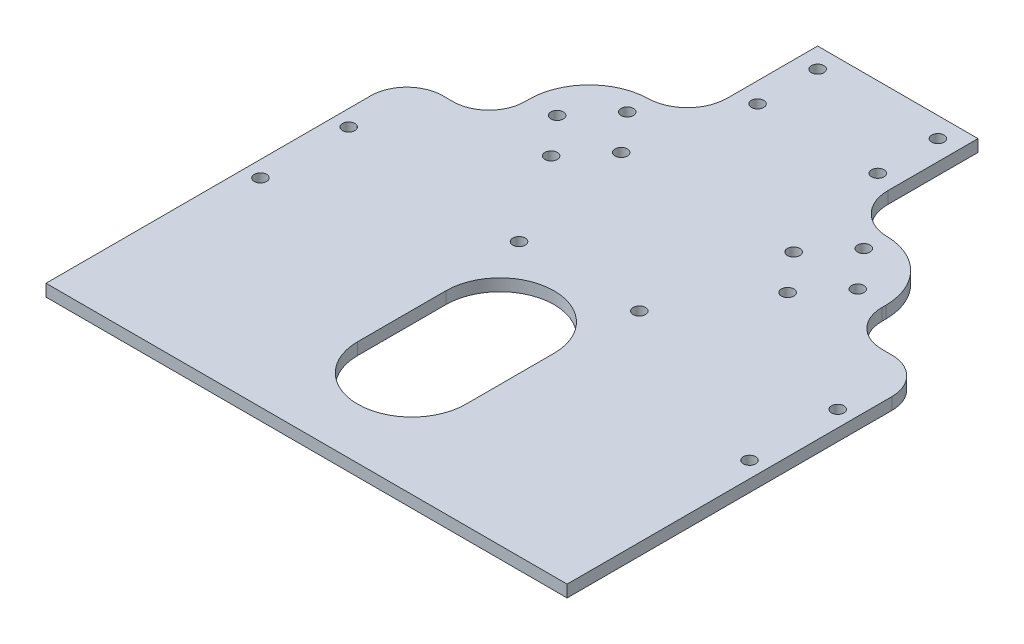
from build123d import *

# Parameters (mm, degrees)
SKETCH_1_W              = 200
SKETCH_1_H              = 200
EXTRUDE_1_DEPTH         = 3
SKETCH_2_R              = 1.55
CUT_EXTRUDE_2_DEPTH     = 10
CUT_EXTRUDE_3_DEPTH     = 10
SKETCH_6_R              = 1.55
CUT_EXTRUDE_3_1_1_DEPTH = 10
SKETCH_7_R              = 1.55
CUT_EXTRUDE_3_1_2_DEPTH = 120.306328416
CUT_EXTRUDE_21_DEPTH    = 10


with BuildPart() as part:
    # 草图1 → 凸台-拉伸1 (new body)
    with BuildSketch(Plane(origin=(0, 0, 0), x_dir=(1, 0, 0), z_dir=(0, 1, 0))):
        Rectangle(SKETCH_1_W, SKETCH_1_H)
    extrude(amount=EXTRUDE_1_DEPTH)

    # 草图2 → 切除-拉伸2 (cut)
    with BuildSketch(Plane(origin=(0, 3, 0), x_dir=(1, 0, 0), z_dir=(0, 1, 0))):
        with Locations(Location((29.5, 9.5, 0), (0, 0, 270))):
            Circle(SKETCH_2_R)
        with Locations(Location((21.5, 0, 0), (0, 0, 270))):
            Circle(SKETCH_2_R)
        with Locations(Location((29.5, -9.5, 0), (0, 0, 270))):
            Circle(SKETCH_2_R)
        with Locations(Location((37.5, 0, 0), (0, 0, 270))):
            Circle(SKETCH_2_R)
        with Locations(Location((-29.5, -9.5, 0), (0, 0, 270))):
            Circle(SKETCH_2_R)
        with Locations(Location((-37.5, 0, 0), (0, 0, 270))):
            Circle(SKETCH_2_R)
        with Locations(Location((-21.5, 0, 0), (0, 0, 270))):
            Circle(SKETCH_2_R)
        with Locations(Location((-29.5, 9.5, 0), (0, 0, 270))):
            Circle(SKETCH_2_R)
        with Locations(Location((-15, -32, 0), (0, 0, 270))):
            Circle(SKETCH_2_R)
        with Locations(Location((15, -32, 0), (0, 0, 270))):
            Circle(SKETCH_2_R)
    extrude(amount=-CUT_EXTRUDE_2_DEPTH, mode=Mode.SUBTRACT)

    # 草图5 → 切除-拉伸3 (cut)
    with BuildSketch(Plane(origin=(0, 3, 0), x_dir=(1, 0, 0), z_dir=(0, 1, 0))):
        with BuildLine():
            Line((-65, -100), (-189.497959863, -100))
            Line((-189.497959863, -100), (-189.497959863, 163.072140164))
            Line((-189.497959863, 163.072140164), (202.300249071, 163.072140164))
            Line((202.300249071, 163.072140164), (202.300249071, -100))
            Line((202.300249071, -100), (65, -100))
            Line((65, -100), (65, -19))
            ThreePointArc((65, -19), (62.363961031, -12.636038969), (56, -10))
            Line((56, -10), (53.5, -10))
            ThreePointArc((53.5, -10), (47.136038969, -7.363961031), (44.5, -1))
            Line((44.5, -1), (44.5, 0))
            ThreePointArc((44.5, 0), (40.212142643, 10.5), (29.8, 14.9969997))
            ThreePointArc((29.8, 14.9969997), (22.858571571, 17.9949995), (20, 24.9949995))
            Line((20, 24.9949995), (20, 47.5))
            Line((20, 47.5), (0, 47.5))
            Line((0, 47.5), (-20, 47.5))
            Line((-20, 47.5), (-20, 24.9949995))
            ThreePointArc((-20, 24.9949995), (-22.858571571, 17.9949995), (-29.8, 14.9969997))
            ThreePointArc((-29.8, 14.9969997), (-40.212142643, 10.5), (-44.5, 0))
            Line((-44.5, 0), (-44.5, -1))
            ThreePointArc((-44.5, -1), (-47.136038969, -7.363961031), (-53.5, -10))
            Line((-53.5, -10), (-56, -10))
            ThreePointArc((-56, -10), (-62.363961031, -12.636038969), (-65, -19))
            Line((-65, -19), (-65, -100))
        make_face()
    extrude(amount=-CUT_EXTRUDE_3_DEPTH, mode=Mode.SUBTRACT)

    # 草图6 → φ3.1通孔1 (cut)
    with BuildSketch(Plane.XZ):
        with Locations(Location((-15, -42.5, 0), (0, 0, 270))):
            Circle(SKETCH_6_R)
        with Locations(Location((-15, -27.5, 0), (0, 0, 270))):
            Circle(SKETCH_6_R)
        with Locations(Location((15, -27.5, 0), (0, 0, 90))):
            Circle(SKETCH_6_R)
        with Locations(Location((15, -42.5, 0), (0, 0, 90))):
            Circle(SKETCH_6_R)
    extrude(amount=-CUT_EXTRUDE_3_1_1_DEPTH, mode=Mode.SUBTRACT)

    # 草图7 → φ3.1通孔2 (cut, through all)
    with BuildSketch(Plane(origin=(0, 3, 0), x_dir=(1, 0, 0), z_dir=(0, 1, 0))):
        with Locations(Location((-61, -28.5, 0), (0, 0, 270))):
            Circle(SKETCH_7_R)
        with Locations(Location((-61, -50.5, 0), (0, 0, 270))):
            Circle(SKETCH_7_R)
        with Locations(Location((61, -28.5, 0), (0, 0, 270))):
            Circle(SKETCH_7_R)
        with Locations(Location((61, -50.5, 0), (0, 0, 270))):
            Circle(SKETCH_7_R)
    extrude(amount=-CUT_EXTRUDE_3_1_2_DEPTH, mode=Mode.SUBTRACT)

    # 草图9 → φ21拨单电机孔 (cut)
    with BuildSketch(Plane(origin=(0, 3, 0), x_dir=(1, 0, 0), z_dir=(0, 1, 0))):
        with BuildLine():
            Line((-13.5, -51.75), (-13.5, -73.75))
            ThreePointArc((-13.5, -73.75), (0, -87.25), (13.5, -73.75))
            Line((13.5, -73.75), (13.5, -51.75))
            ThreePointArc((13.5, -51.75), (0, -38.25), (-13.5, -51.75))
        make_face()
    extrude(amount=-CUT_EXTRUDE_21_DEPTH, mode=Mode.SUBTRACT)


solid = part.part
